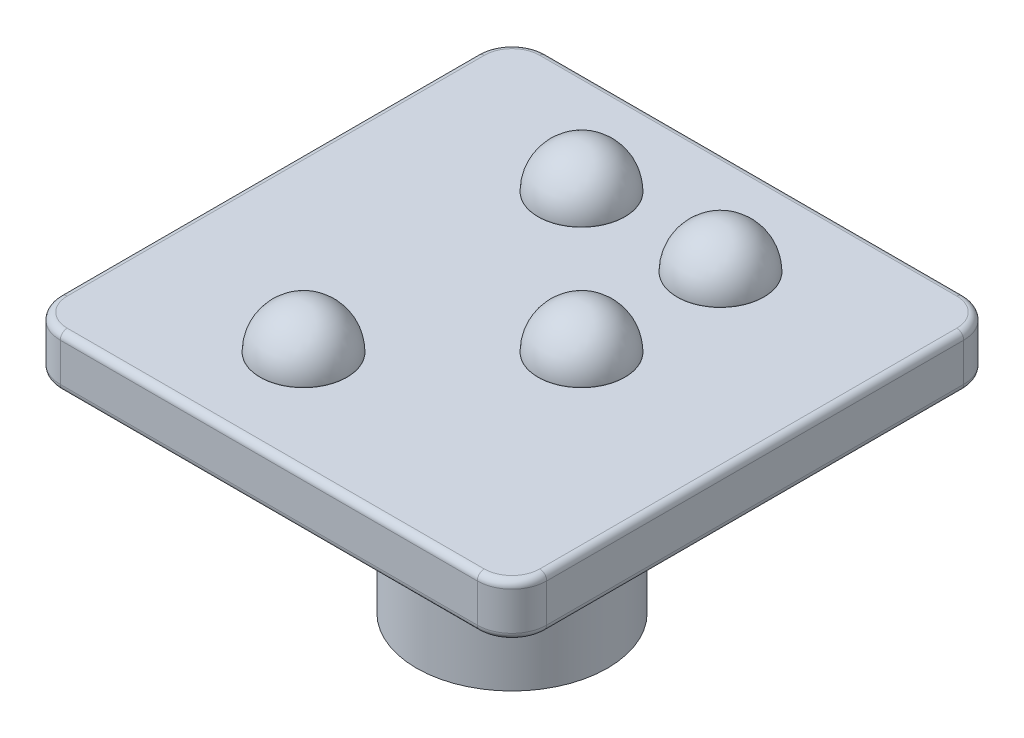
from build123d import *

# Parameters (mm, degrees)
BOSS_EXTRUDE1_DEPTH = 1.5
SKETCH2_R           = 2.75
BOSS_EXTRUDE2_DEPTH = 6
SKETCH3_W           = 1.1
SKETCH3_H           = 1.45
SKETCH3_W_2         = 1.45
SKETCH3_H_2         = 1.1
CUT_EXTRUDE1_DEPTH  = 6
CHAMFER1_SIZE       = 0.3
FILLET1_R           = 1
SKETCH4_R           = 1.25
BOSS_EXTRUDE3_DEPTH = 0.01
DOME1_FACE_RADIUS   = 1.25
DOME1_HEIGHT        = 1.25
DOME2_FACE_RADIUS   = 1.25
DOME2_HEIGHT        = 1.25
DOME4_FACE_RADIUS   = 1.25
DOME4_HEIGHT        = 1.25
DOME5_FACE_RADIUS   = 1.25
DOME5_HEIGHT        = 1.25
FILLET3_R           = 0.2


with BuildPart() as part:
    # Sketch1 → Boss-Extrude1 (new body)
    with BuildSketch(Plane(origin=(0, 0, 0), x_dir=(1, 0, 0), z_dir=(0, 1, 0))):
        with BuildLine():
            Line((-7.324675649, 4.396717546), (4.675324351, 4.396717546))
            ThreePointArc((4.675324351, 4.396717546), (5.382431132, 4.103824327), (5.675324351, 3.396717546))
            Line((5.675324351, 3.396717546), (5.675324351, -8.603282454))
            ThreePointArc((5.675324351, -8.603282454), (5.382431132, -9.310389235), (4.675324351, -9.603282454))
            Line((4.675324351, -9.603282454), (-7.324675649, -9.603282454))
            ThreePointArc((-7.324675649, -9.603282454), (-8.03178243, -9.310389235), (-8.324675649, -8.603282454))
            Line((-8.324675649, -8.603282454), (-8.324675649, 3.396717546))
            ThreePointArc((-8.324675649, 3.396717546), (-8.03178243, 4.103824327), (-7.324675649, 4.396717546))
        make_face()
    extrude(amount=BOSS_EXTRUDE1_DEPTH)

    # Sketch2 → Boss-Extrude2 (add)
    with BuildSketch(Plane.XZ):
        with Locations(Location((-1.324675649, 2.603282454, 0), (0, 0, 270))):
            Circle(SKETCH2_R)
    extrude(amount=BOSS_EXTRUDE2_DEPTH)

    # Sketch3 → Cut-Extrude1 (cut)
    with BuildSketch(Plane.XZ.offset(6)):
        with Locations((-1.324675649, 3.878282454)):
            Rectangle(SKETCH3_W, SKETCH3_H)
        with Locations((-0.049675649, 2.603282454)):
            Rectangle(SKETCH3_W_2, SKETCH3_H_2)
        with Locations((-1.324675649, 2.603282454)):
            Rectangle(SKETCH3_W, SKETCH3_H_2)
        with Locations((-2.599675649, 2.603282454)):
            Rectangle(SKETCH3_W_2, SKETCH3_H_2)
        with Locations((-1.324675649, 1.328282454)):
            Rectangle(SKETCH3_W, SKETCH3_H)
    extrude(amount=-CUT_EXTRUDE1_DEPTH, mode=Mode.SUBTRACT)

    # Chamfer1
    chamfer1_edges = [part.edges().sort_by_distance(p)[0] for p in [
        (-0.774675649, -6, 3.878282454),
        (-0.049675649, -6, 3.153282454),
        (0.675324351, -6, 2.603282454),
        (-0.774675649, -6, 1.328282454),
        (-2.599675649, -6, 3.153282454),
        (-1.324675649, -6, 4.603282454),
        (-1.874675649, -6, 3.878282454),
        (-3.324675649, -6, 2.603282454),
        (-2.599675649, -6, 2.053282454),
        (-1.874675649, -6, 1.328282454),
        (-1.324675649, -6, 0.603282454),
        (-0.049675649, -6, 2.053282454),
    ]]
    chamfer(chamfer1_edges, length=CHAMFER1_SIZE)

    # Fillet1
    fillet1_edges = [part.edges().sort_by_distance(p)[0] for p in [
        (-1.324675649, 0, 5.353282454),
    ]]
    fillet(fillet1_edges, radius=FILLET1_R)

    # Sketch4 → Boss-Extrude3 (add)
    with BuildSketch(Plane(origin=(0, 1.5, 0), x_dir=(1, 0, 0), z_dir=(0, 1, 0))):
        with Locations(Location((-3.324675649, 1.396717546, 0), (0, 0, 90))):
            Circle(SKETCH4_R)
        with Locations(Location((0.675324351, -2.603282454, 0), (0, 0, 90))):
            Circle(SKETCH4_R)
        with Locations(Location((-3.324675649, -6.603282454, 0), (0, 0, 90))):
            Circle(SKETCH4_R)
        with Locations(Location((0.675324351, 1.396717546, 0), (0, 0, 90))):
            Circle(SKETCH4_R)
    extrude(amount=BOSS_EXTRUDE3_DEPTH)

    # Dome1: a dome of height H over a round flat face of radius A is a cap of a sphere of radius (A * A + H * H) / (2 * H)
    dome1_r = (DOME1_FACE_RADIUS * DOME1_FACE_RADIUS + DOME1_HEIGHT * DOME1_HEIGHT) / (2 * DOME1_HEIGHT)
    dome1_base = Plane((-3.324675649, 1.51, -1.396717546), z_dir=(0, 1, 0))
    with Locations(dome1_base.offset(DOME1_HEIGHT - dome1_r)):
        dome1_ball = Sphere(dome1_r, mode=Mode.PRIVATE)
    add(split(dome1_ball, bisect_by=dome1_base, keep=Keep.TOP, mode=Mode.PRIVATE))

    # Dome2: a dome of height H over a round flat face of radius A is a cap of a sphere of radius (A * A + H * H) / (2 * H)
    dome2_r = (DOME2_FACE_RADIUS * DOME2_FACE_RADIUS + DOME2_HEIGHT * DOME2_HEIGHT) / (2 * DOME2_HEIGHT)
    dome2_base = Plane((0.675324351, 1.51, -1.396717546), z_dir=(0, 1, 0))
    with Locations(dome2_base.offset(DOME2_HEIGHT - dome2_r)):
        dome2_ball = Sphere(dome2_r, mode=Mode.PRIVATE)
    add(split(dome2_ball, bisect_by=dome2_base, keep=Keep.TOP, mode=Mode.PRIVATE))

    # Dome4: a dome of height H over a round flat face of radius A is a cap of a sphere of radius (A * A + H * H) / (2 * H)
    dome4_r = (DOME4_FACE_RADIUS * DOME4_FACE_RADIUS + DOME4_HEIGHT * DOME4_HEIGHT) / (2 * DOME4_HEIGHT)
    dome4_base = Plane((0.675324351, 1.51, 2.603282454), z_dir=(0, 1, 0))
    with Locations(dome4_base.offset(DOME4_HEIGHT - dome4_r)):
        dome4_ball = Sphere(dome4_r, mode=Mode.PRIVATE)
    add(split(dome4_ball, bisect_by=dome4_base, keep=Keep.TOP, mode=Mode.PRIVATE))

    # Dome5: a dome of height H over a round flat face of radius A is a cap of a sphere of radius (A * A + H * H) / (2 * H)
    dome5_r = (DOME5_FACE_RADIUS * DOME5_FACE_RADIUS + DOME5_HEIGHT * DOME5_HEIGHT) / (2 * DOME5_HEIGHT)
    dome5_base = Plane((-3.324675649, 1.51, 6.603282454), z_dir=(0, 1, 0))
    with Locations(dome5_base.offset(DOME5_HEIGHT - dome5_r)):
        dome5_ball = Sphere(dome5_r, mode=Mode.PRIVATE)
    add(split(dome5_ball, bisect_by=dome5_base, keep=Keep.TOP, mode=Mode.PRIVATE))

    # Fillet3
    fillet3_edges = [part.edges().sort_by_distance(p)[0] for p in [
        (5.382431132, 1.5, 9.310389235),
        (-1.324675649, 0, 9.603282454),
        (-8.03178243, 0, 9.310389235),
        (5.675324351, 1.5, 2.603282454),
        (5.382431132, 1.5, -4.103824327),
        (-1.324675649, 1.5, -4.396717546),
        (-8.03178243, 1.5, -4.103824327),
        (-8.324675649, 1.5, 2.603282454),
        (-8.03178243, 1.5, 9.310389235),
        (-1.324675649, 1.5, 9.603282454),
        (-8.324675649, 0, 2.603282454),
        (-8.03178243, 0, -4.103824327),
        (-1.324675649, 0, -4.396717546),
        (5.382431132, 0, -4.103824327),
        (5.675324351, 0, 2.603282454),
        (5.382431132, 0, 9.310389235),
    ]]
    fillet(fillet3_edges, radius=FILLET3_R)


solid = part.part
